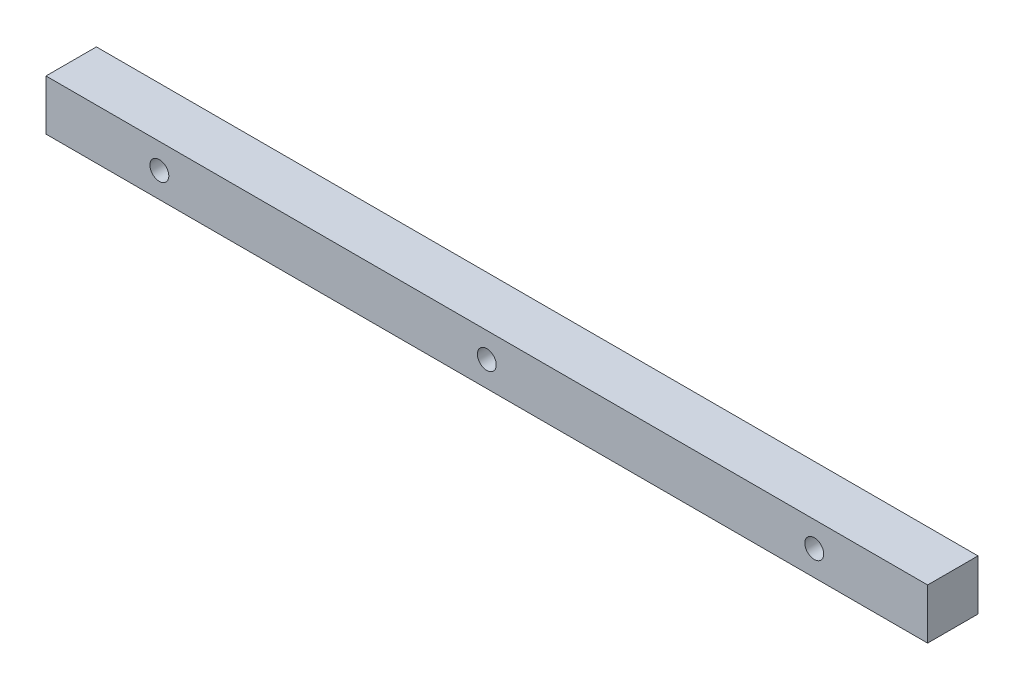
from build123d import *

# Parameters (mm, degrees)
SKETCH_1_W      = 140
SKETCH_1_H      = 8
SKETCH_1_R      = 1.5
EXTRUDE_1_DEPTH = 8


with BuildPart() as part:
    # 草图1 → 凸台-拉伸1 (new body)
    with BuildSketch(Plane.XY):
        with Locations((70, 4)):
            Rectangle(SKETCH_1_W, SKETCH_1_H)
        with Locations((70, 4)):
            Circle(SKETCH_1_R, mode=Mode.SUBTRACT)
        with Locations((18, 4)):
            Circle(SKETCH_1_R, mode=Mode.SUBTRACT)
        with Locations(Location((122, 4, 0), (0, 0, 180))):
            Circle(SKETCH_1_R, mode=Mode.SUBTRACT)
    extrude(amount=EXTRUDE_1_DEPTH)


solid = part.part
